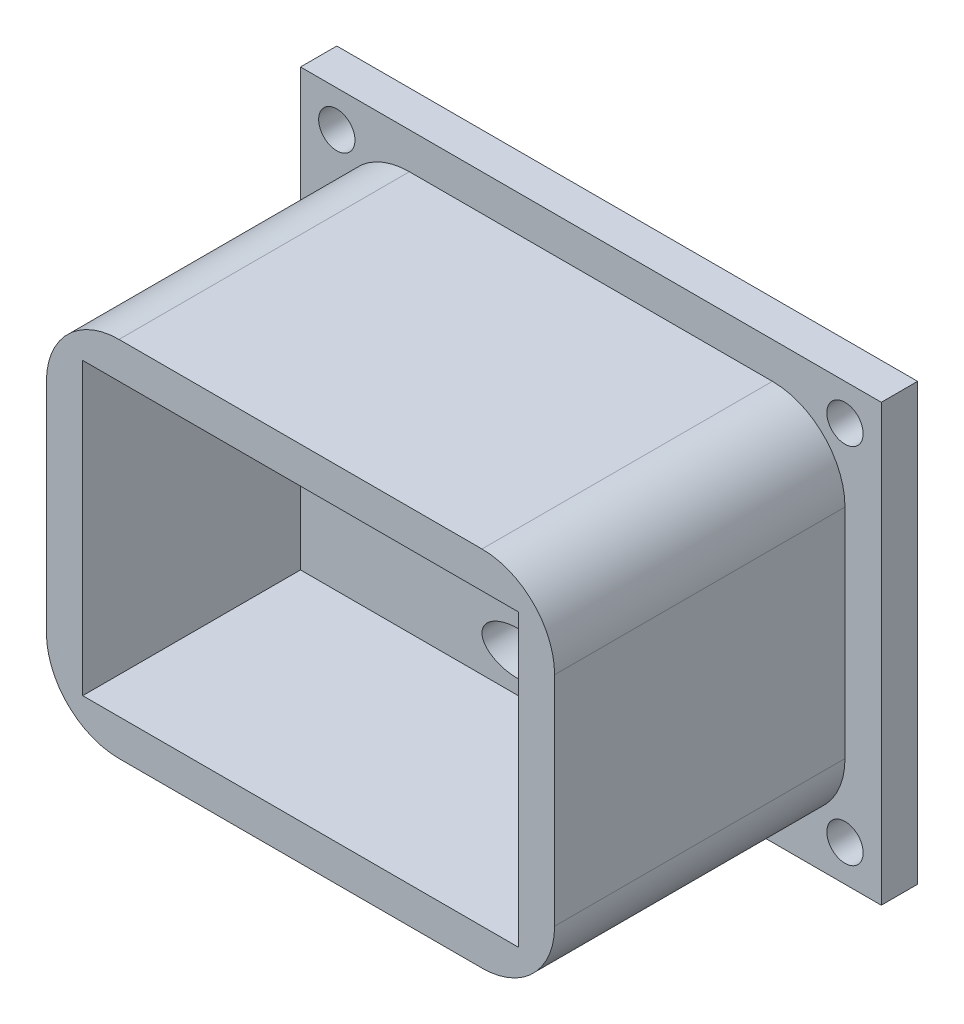
from build123d import *

# Parameters (mm, degrees)
SKETCH1_W           = 70
SKETCH1_H           = 50
BOSS_EXTRUDE1_DEPTH = 40
SKETCH2_W           = 60
SKETCH2_H           = 40
CUT_EXTRUDE1_DEPTH  = 30
BOSS_EXTRUDE2_DEPTH = 5
FILLET1_R           = 10
SKETCH5_R           = 2.5
CUT_EXTRUDE2_DEPTH  = 5
SKETCH6_RX          = 5
SKETCH6_RY          = 3
CUT_EXTRUDE3_DEPTH  = 20


with BuildPart() as part:
    # Sketch1 → Boss-Extrude1 (new body)
    with BuildSketch(Plane.XY):
        with Locations((35, 25)):
            Rectangle(SKETCH1_W, SKETCH1_H)
    extrude(amount=BOSS_EXTRUDE1_DEPTH)

    # Sketch2 → Cut-Extrude1 (cut)
    with BuildSketch(Plane.XY.offset(40)):
        with Locations((35, 25)):
            Rectangle(SKETCH2_W, SKETCH2_H)
    extrude(amount=-CUT_EXTRUDE1_DEPTH, mode=Mode.SUBTRACT)

    # Sketch4 → Boss-Extrude2 (add)
    with BuildSketch(Plane(origin=(0, 0, 0), x_dir=(-1, 0, 0), z_dir=(0, 0, -1))):
        Polygon((-75, 50), (-75, 55), (5, 55), (5, -5), (-75, -5), align=None)
    extrude(amount=BOSS_EXTRUDE2_DEPTH)

    # Fillet1
    fillet1_edges = [part.edges().sort_by_distance(p)[0] for p in [
        (0, 50, 20),
        (70, 50, 20),
        (70, 0, 20),
        (0, 0, 20),
    ]]
    fillet(fillet1_edges, radius=FILLET1_R)

    # Sketch5 → Cut-Extrude2 (cut)
    with BuildSketch(Plane.XY):
        with Locations((0, 50)):
            Circle(SKETCH5_R)
        with Locations((70, 50)):
            Circle(SKETCH5_R)
        with Locations((70, 0)):
            Circle(SKETCH5_R)
        Circle(SKETCH5_R)
    extrude(amount=-CUT_EXTRUDE2_DEPTH, mode=Mode.SUBTRACT)

    # Sketch6 → Cut-Extrude3 (cut)
    with BuildSketch(Plane.XY.offset(10)):
        with Locations(Location((35, 10), (0, 0, 180))):
            Ellipse(SKETCH6_RX, SKETCH6_RY)
    extrude(amount=-CUT_EXTRUDE3_DEPTH, mode=Mode.SUBTRACT)


solid = part.part
